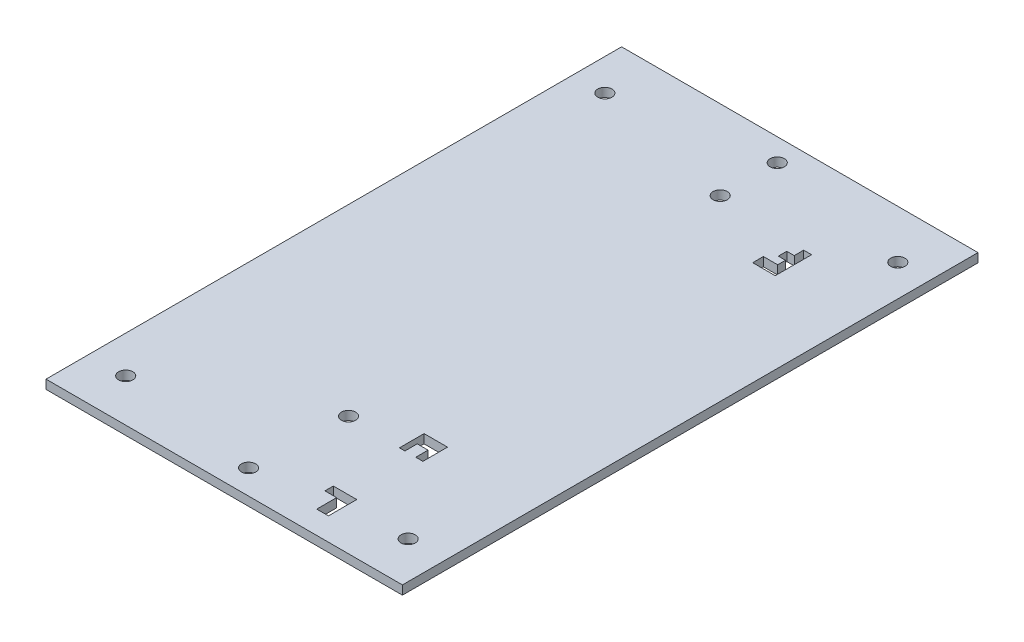
from build123d import *

# Parameters (mm, degrees)
SKETCH1_W           = 254
SKETCH1_H           = 410.21
SKETCH1_R           = 5.08
BOSS_EXTRUDE1_DEPTH = 6.35


with BuildPart() as part:
    # Sketch1 → Boss-Extrude1 (new body)
    with BuildSketch(Plane(origin=(0, 0, 0), x_dir=(1, 0, 0), z_dir=(0, 1, 0))):
        with Locations((0, 78.589199082)):
            Rectangle(SKETCH1_W, SKETCH1_H)
        with Locations(Location((-100.6380512, -96.068481922, 0), (0, 0, 270))):
            Circle(SKETCH1_R, mode=Mode.SUBTRACT)
        with Locations(Location((100.6380512, -96.068481922, 0), (0, 0, 270))):
            Circle(SKETCH1_R, mode=Mode.SUBTRACT)
        with Locations(Location((0, 226.966451634, 0), (0, 0, 270))):
            Circle(SKETCH1_R, mode=Mode.SUBTRACT)
        with Locations(Location((0, 267.609461393, 0), (0, 0, 270))):
            Circle(SKETCH1_R, mode=Mode.SUBTRACT)
        with Locations(Location((-104.394, 249.148548959, 0), (0, 0, 270))):
            Circle(SKETCH1_R, mode=Mode.SUBTRACT)
        with Locations(Location((104.394, 249.148548959, 0), (0, 0, 270))):
            Circle(SKETCH1_R, mode=Mode.SUBTRACT)
        with Locations(Location((3.666326597, -41.569496857, 0), (0, 0, 270))):
            Circle(SKETCH1_R, mode=Mode.SUBTRACT)
        with Locations(Location((0, -109.13772467, 0), (0, 0, 270))):
            Circle(SKETCH1_R, mode=Mode.SUBTRACT)
        Polygon((69.012885603, 197.173617012), (52.948455079, 197.173617012), (52.948455079, 204.798194528), (63.135298998, 204.798194528), (63.135298998, 210.354654847), (58.041877039, 210.354654847), (58.041877039, 216.374153526), (63.366818178, 216.374153526), (63.366818178, 223.088209746), (69.012885603, 223.088209746), align=None, mode=Mode.SUBTRACT)
        Polygon((41.345742309, -42.951444708), (41.345742309, -25.410434465), (58.041877039, -25.410434465), (58.041877039, -42.951444708), (52.948455079, -42.951444708), (52.948455079, -34.180939586), (45.23941523, -34.180939586), (45.23941523, -42.951444708), align=None, mode=Mode.SUBTRACT)
        Polygon((58.041877039, -110.261456825), (58.041877039, -90.093932087), (41.345742309, -90.093932087), (41.345742309, -96.068481922), (49.693809674, -96.068481922), (49.693809674, -110.261456825), align=None, mode=Mode.SUBTRACT)
    extrude(amount=BOSS_EXTRUDE1_DEPTH)


solid = part.part
